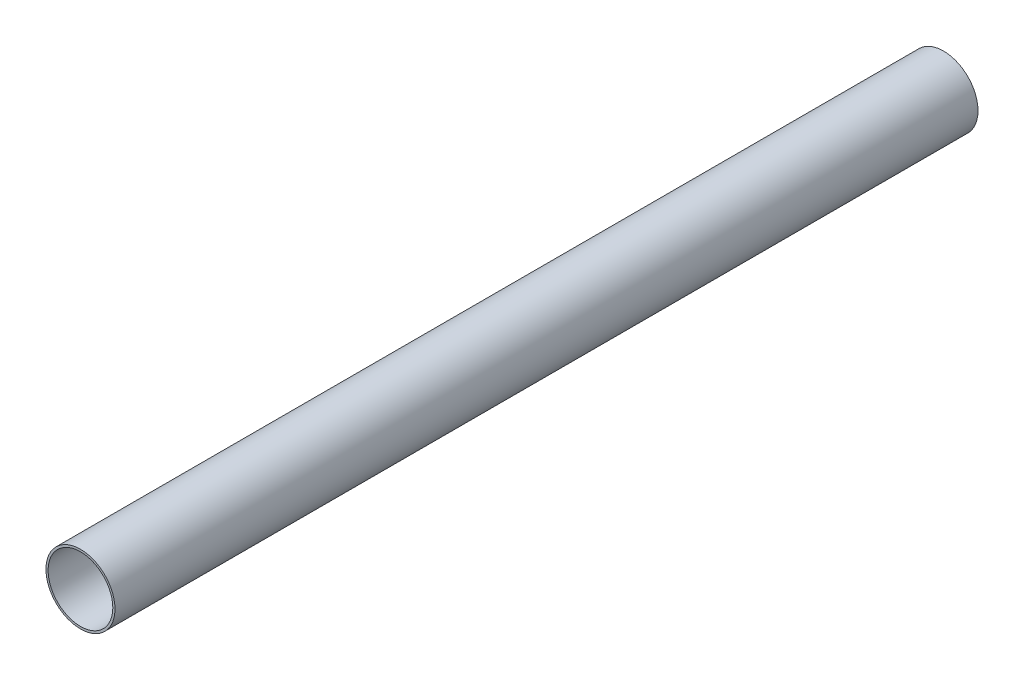
from build123d import *

# Parameters (mm, degrees)
SKETCH1_R           = 16
SKETCH1_R_2         = 15
BOSS_EXTRUDE1_DEPTH = 400


with BuildPart() as part:
    # Sketch1 → Boss-Extrude1 (new body)
    with BuildSketch(Plane.XY):
        Circle(SKETCH1_R)
        Circle(SKETCH1_R_2, mode=Mode.SUBTRACT)
    extrude(amount=BOSS_EXTRUDE1_DEPTH)


solid = part.part
